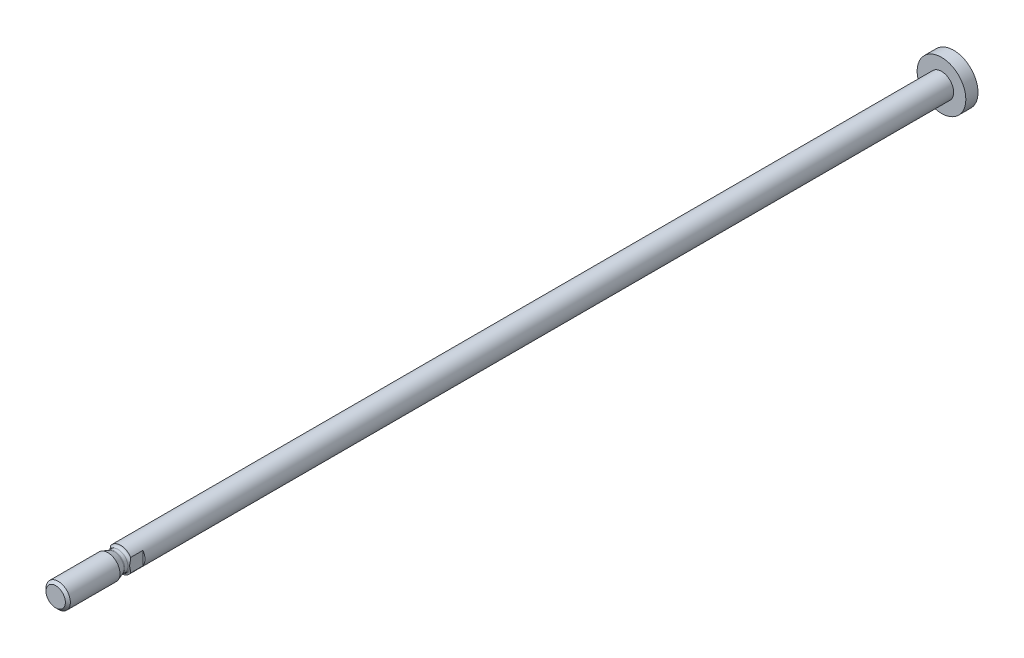
from build123d import *

# Parameters (mm, degrees)
SCHNITT_LINEAR_AUSTRAGEN1_DEPTH = 4


with BuildPart() as part:
    # Skizze1 → Rotation1 (revolve)
    with BuildSketch(Plane(origin=(0, 0, 0), x_dir=(0, 0, -1), z_dir=(1, 0, 0))):
        Polygon((-5, 0), (-5, 3), (197.3, 3), (197.3, 6), (200.3, 6), (200.3, 0), align=None)
    revolve(axis=Axis((0, 0, -200.3), (0, 0, 1)))

    # Skizze2 → Rotation2 (revolve)
    with BuildSketch(Plane(origin=(0, 0, 0), x_dir=(0, 0, -1), z_dir=(1, 0, 0))):
        with BuildLine():
            Line((-21, 0), (-21, 2.3865))
            Line((-21, 2.3865), (-20.3865, 3))
            Line((-20.3865, 3), (-8.148486452, 3))
            Line((-8.148486452, 3), (-6.599415898, 2.436184428))
            ThreePointArc((-6.599415898, 2.436184428), (-6.498392718, 2.409115348), (-6.394203812, 2.4))
            Line((-6.394203812, 2.4), (-5.6, 2.4))
            ThreePointArc((-5.6, 2.4), (-5.175735931, 2.575735931), (-5, 3))
            Line((-5, 3), (-4, 3))
            Line((-4, 3), (-4, 0))
            Line((-4, 0), (-21, 0))
        make_face()
    revolve(axis=Axis((0, 0, 4), (0, 0, 1)))

    # Skizze3 → Schnitt-Linear austragen1 (cut)
    with BuildSketch(Plane.XY.offset(2)):
        Polygon((-5, 10), (-5, -5), (-2.5, -5), (-2.5, 5), (2.5, 5), (2.5, -5), (5, -5), (5, 10), align=None)
    extrude(amount=SCHNITT_LINEAR_AUSTRAGEN1_DEPTH, mode=Mode.SUBTRACT)


solid = part.part
